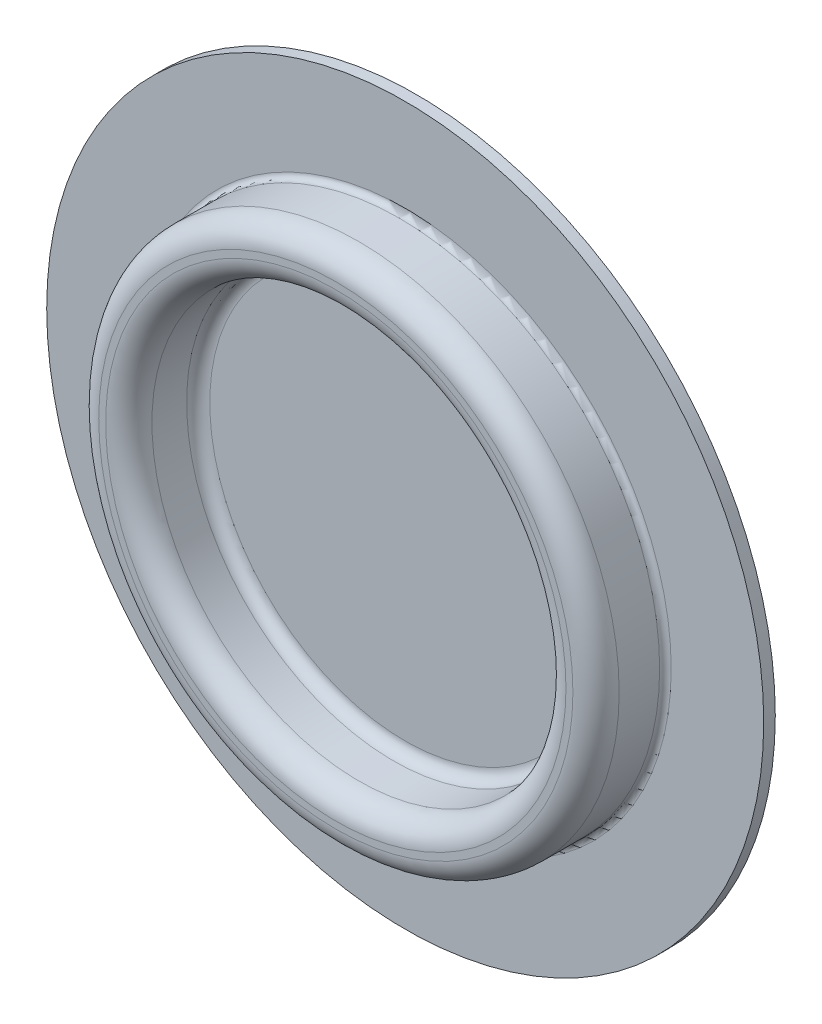
from build123d import *


with BuildPart() as part:
    # Croquis1 → Revolución1 (revolve)
    with BuildSketch(Plane(origin=(0, 0, 0), x_dir=(0, 0, -1), z_dir=(1, 0, 0)), mode=Mode.PRIVATE) as revoluci_n1_sk:
        with BuildLine():
            Line((-1, 31), (-1, 23))
            ThreePointArc((-1, 23), (-1.146446609, 22.646446609), (-1.5, 22.5))
            Line((-1.5, 22.5), (-5, 22.5))
            ThreePointArc((-5, 22.5), (-6.414213562, 21.914213562), (-7, 20.5))
            Line((-7, 20.5), (-7, 19.9))
            ThreePointArc((-7, 19.9), (-6.414213562, 18.485786438), (-5, 17.9))
            Line((-5, 17.9), (-2, 17.9))
            ThreePointArc((-2, 17.9), (-1.292893219, 17.607106781), (-1, 16.9))
            Line((-1, 16.9), (-1, 0))
            Line((-1, 0), (5e-09, 0))
            Line((5e-09, 0), (0, 16.9))
            ThreePointArc((0, 16.9), (-0.585786438, 18.314213562), (-2, 18.9))
            Line((-2, 18.9), (-5, 18.9))
            ThreePointArc((-5, 18.9), (-5.707106781, 19.192893219), (-6, 19.9))
            Line((-6, 19.9), (-6, 20.5))
            ThreePointArc((-6, 20.5), (-5.707106781, 21.207106781), (-5, 21.5))
            Line((-5, 21.5), (-1.5, 21.5))
            ThreePointArc((-1.5, 21.5), (-0.439339828, 21.939339828), (0, 23))
            Line((0, 23), (0, 31))
            Line((0, 31), (-1, 31))
        make_face()
    revolve(revoluci_n1_sk.sketch.rotate(Axis((0, 0, 74.476992057), (0, 0, -1)), 90), axis=Axis((0, 0, 74.476992057), (0, 0, -1)))


solid = part.part
